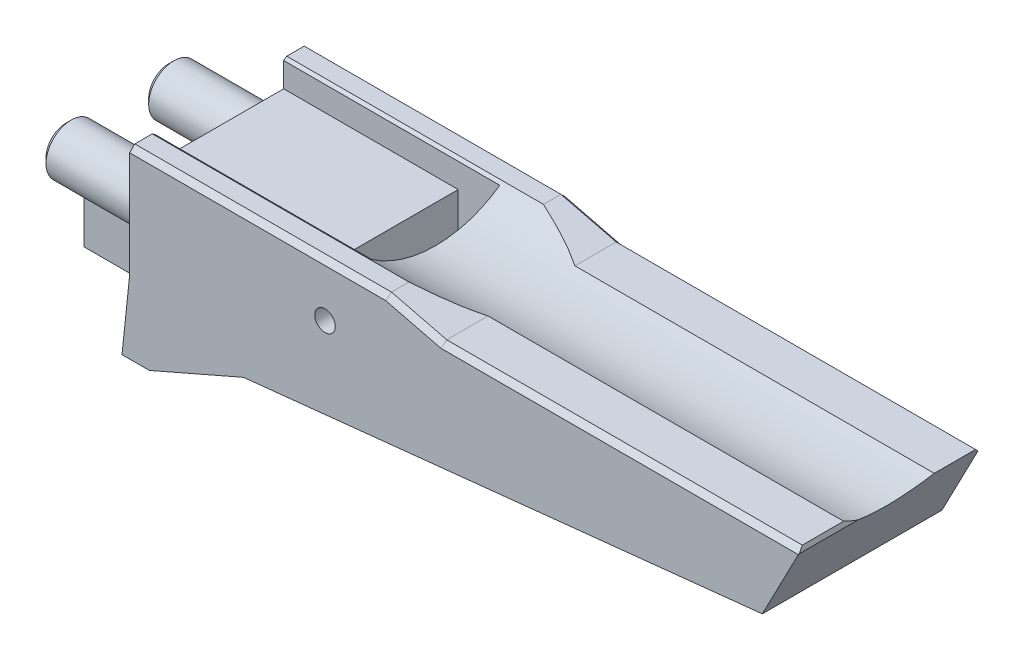
from build123d import *
from OCP.BRepFilletAPI import BRepFilletAPI_MakeChamfer

# Parameters (mm, degrees)
EXTRUDE_1_DEPTH     = 17.5
CUT_EXTRUDE_1_DEPTH = 12.5
CUT_EXTRUDE_2_DEPTH = 135
CHAMFER_1_SIZE      = 1
CHAMFER_1_SIZE2     = 0.741639712
SKETCH_4_R          = 4.9
SKETCH_4_W          = 14.9
SKETCH_4_H          = 9.8
EXTRUDE_2_DEPTH     = 19.9
CHAMFER_2_SIZE      = 1
SKETCH_8_R          = 2
CUT_EXTRUDE_5_DEPTH = 141.031269382


with BuildPart() as part:
    # 스케치1 → 보스-돌출1 (new, symmetric)
    with BuildSketch(Plane.XY):
        Polygon((0, 0), (50, 0), (60.774208204, -2.663057759), (130.774208204, -2.663057759), (123.239760601, -17.169499956), (22.168183174, -27.799088209), (3.828389762, -35.803112621), (-1.495960418, -35.803112621), (0, -21.57), align=None)
    extrude(amount=EXTRUDE_1_DEPTH, both=True)

    # 스케치2 → 컷-돌출1 (cut, symmetric)
    with BuildSketch(Plane.XY):
        Polygon((0, 0), (0, -5.2), (34, -5.2), (34, -18.4), (42.1, -18.4), (42.1, 0), align=None)
    extrude(amount=CUT_EXTRUDE_1_DEPTH, both=True, mode=Mode.SUBTRACT)

    # 스케치3 → 컷-돌출2 (cut)
    with BuildSketch(Plane(origin=(0, 0, 0), x_dir=(0, 0, -1), z_dir=(1, 0, 0))):
        with BuildLine():
            Line((13.1, 0), (-13.1, 0))
            ThreePointArc((-13.1, 0), (0, -4.369440217), (13.1, 0))
        make_face()
    extrude(amount=CUT_EXTRUDE_2_DEPTH, mode=Mode.SUBTRACT)

    # 모따기1: one chamfer whose edges measure the first distance from different faces: ONE call of the kernel's chamfer builder (chamfer() names one face for all edges)
    chamfer_1_edges_1 = [part.edges().sort_by_distance(p)[0] for p in [
        (130.774208204, -2.663057759, 12.979729839),
    ]]
    chamfer_1_side_1 = [part.faces().sort_by_distance(p)[0] for p in [
        (126.871435624, -10.177257582, 0),
    ]]
    chamfer_1_edges_2 = [part.edges().sort_by_distance(p)[0] for p in [
        (95.774208204, -2.663057759, 17.5),
        (55.387104102, -1.331528879, 17.5),
        (25, 0, 17.5),
        (25, 0, -17.5),
        (55.387104102, -1.331528879, -17.5),
        (95.774208204, -2.663057759, -17.5),
    ]]
    chamfer_1 = BRepFilletAPI_MakeChamfer(part.part.solid().wrapped)
    for e in chamfer_1_edges_1:
        chamfer_1.Add(CHAMFER_1_SIZE, CHAMFER_1_SIZE2, e.wrapped, chamfer_1_side_1[0].wrapped)  # the first distance lies on this face
    for e in chamfer_1_edges_2:
        chamfer_1.Add(CHAMFER_1_SIZE, e.wrapped)
    add(Compound.cast(chamfer_1.Shape()), mode=Mode.REPLACE)

    # 스케치4 → 보스-돌출2 (add)
    with BuildSketch(Plane.ZY):
        with Locations(Location((10, -13.57, 0), (0, 0, 90))):
            Circle(SKETCH_4_R)
        with Locations(Location((-10, -13.57, 0), (0, 0, 90))):
            Circle(SKETCH_4_R)
        with Locations((0, -26.47)):
            Rectangle(SKETCH_4_W, SKETCH_4_H)
    extrude(amount=EXTRUDE_2_DEPTH)

    # 모따기2
    chamfer_2_edges = [part.edges().sort_by_distance(p)[0] for p in [
        (-19.9, -18.47, -10),
        (-19.9, -26.47, 7.45),
        (-19.9, -21.57, 0),
        (-19.9, -26.47, -7.45),
        (-19.9, -31.37, 0),
        (-19.9, -18.47, 10),
    ]]
    chamfer(chamfer_2_edges, length=CHAMFER_2_SIZE)

    # 스케치8 → 컷-돌출5 (cut, through all)
    with BuildSketch(Plane.XY.offset(17.5)):
        with Locations((38.05, -10.3)):
            Circle(SKETCH_8_R)
    extrude(amount=-CUT_EXTRUDE_5_DEPTH, mode=Mode.SUBTRACT)


solid = part.part
